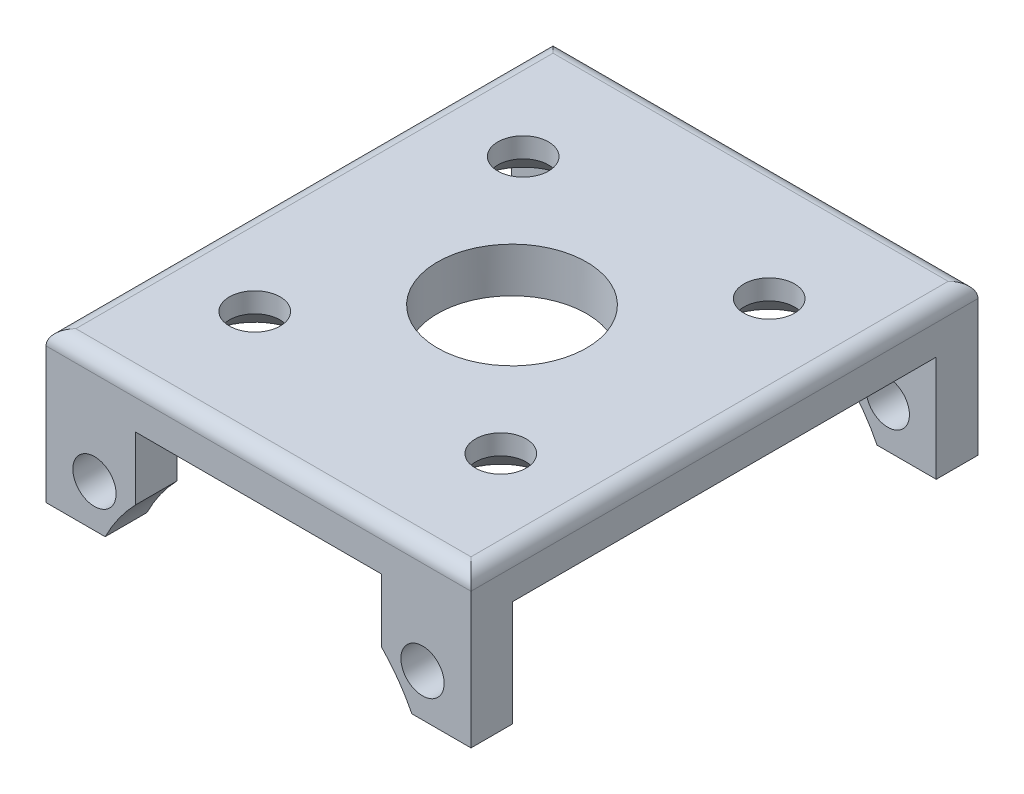
from build123d import *

# Parameters (mm, degrees)
BOSS_EXTRUDE7_DEPTH                          = 17
BOSS_EXTRUDE7_DEPTH_BACK                     = 17
SKETCH1_R                                    = 1.45
SKETCH34_W                                   = 28.4
SKETCH34_H                                   = 7.5
CUT_EXTRUDE11_DEPTH                          = 37.521397837
SKETCH35_R                                   = 5
CUT_EXTRUDE12_DEPTH                          = 25.542055741
CSK_FOR_M3_HEX_SOCKET_COUNTERSUNK_CA_2_COUNT = 2
CSK_FOR_M3_HEX_SOCKET_COUNTERSUNK_CA_2_PITCH = 16.5
CSK_FOR_M3_HEX_SOCKET_COUNTERSUNK_CA_3_COUNT = 2
CSK_FOR_M3_HEX_SOCKET_COUNTERSUNK_CA_3_PITCH = 18
CSK_FOR_M3_HEX_SOCKET_COUNTERSUNK_CA_4_COUNT = 2
CSK_FOR_M3_HEX_SOCKET_COUNTERSUNK_CA_4_PITCH = 24.418230894
FILLET5_R                                    = 1
SKETCH41_W                                   = 28.5
SKETCH41_H                                   = 0.4
CUT_EXTRUDE13_DEPTH                          = 40.895175147


with BuildPart() as part:
    # Sketch1 → Boss-Extrude7 (new, two sides: drawn at the far end of the back side and taken through both)
    with BuildSketch(Plane.XY.offset(-BOSS_EXTRUDE7_DEPTH_BACK)):
        with BuildLine():
            Line((-14.25, 15.25), (-14.25, 4.75))
            Line((-14.25, 4.75), (-10.473180033, 4.75))
            ThreePointArc((-10.473180033, 4.75), (-9.502581542, 6.476954843), (-8.25, 8.011710179))
            Line((-8.25, 8.011710179), (-8.25, 12.25))
            Line((-8.25, 12.25), (8.25, 12.25))
            Line((8.25, 12.25), (8.25, 8.011710179))
            ThreePointArc((8.25, 8.011710179), (9.502581542, 6.476954843), (10.473180033, 4.75))
            Line((10.473180033, 4.75), (14.25, 4.75))
            Line((14.25, 4.75), (14.25, 15.25))
            Line((14.25, 15.25), (-14.25, 15.25))
        make_face()
        with Locations((11, 8)):
            Circle(SKETCH1_R, mode=Mode.SUBTRACT)
        with Locations((-11, 8)):
            Circle(SKETCH1_R, mode=Mode.SUBTRACT)
    extrude(amount=BOSS_EXTRUDE7_DEPTH + BOSS_EXTRUDE7_DEPTH_BACK)

    # Sketch34 → Cut-Extrude11 (cut, through all)
    with BuildSketch(Plane.ZY.offset(14.25)):
        with Locations((0, 8.5)):
            Rectangle(SKETCH34_W, SKETCH34_H)
    extrude(amount=-CUT_EXTRUDE11_DEPTH, mode=Mode.SUBTRACT)

    # Sketch35 → Cut-Extrude12 (cut, through all)
    with BuildSketch(Plane(origin=(0, 15.25, 0), x_dir=(1, 0, 0), z_dir=(0, 1, 0))):
        Circle(SKETCH35_R)
    extrude(amount=-CUT_EXTRUDE12_DEPTH, mode=Mode.SUBTRACT)

    # Sketch40 → CSK for M3 Hex Socket Countersunk Cap Screw3 (revolve, cut)
    with BuildSketch(Plane(origin=(-8.25, 12.25, 9), x_dir=(0, 0, -1), z_dir=(1, 0, 0))):
        Polygon((0, 0), (0, 3), (1.7, 3), (1.7, 1.66), (3.36, 0), align=None)
    csk_for_m3_hex_socket_countersunk_cap_sc = revolve(axis=Axis((-8.25, 5.9, 9), (0, 1, 0)), mode=Mode.SUBTRACT)

    # CSK for M3 Hex Socket Countersunk Ca 2: CSK for M3 Hex Socket Countersunk Cap Screw3 ×2
    with Locations(*[(i * CSK_FOR_M3_HEX_SOCKET_COUNTERSUNK_CA_2_PITCH, 0, 0) for i in range(1, CSK_FOR_M3_HEX_SOCKET_COUNTERSUNK_CA_2_COUNT)]):
        add(csk_for_m3_hex_socket_countersunk_cap_sc, mode=Mode.SUBTRACT)

    # CSK for M3 Hex Socket Countersunk Ca 3: CSK for M3 Hex Socket Countersunk Cap Screw3 ×2
    with Locations(*[(0, 0, -i * CSK_FOR_M3_HEX_SOCKET_COUNTERSUNK_CA_3_PITCH) for i in range(1, CSK_FOR_M3_HEX_SOCKET_COUNTERSUNK_CA_3_COUNT)]):
        add(csk_for_m3_hex_socket_countersunk_cap_sc, mode=Mode.SUBTRACT)

    # CSK for M3 Hex Socket Countersunk Ca 4: CSK for M3 Hex Socket Countersunk Cap Screw3 ×2
    with Locations(*[Vector(0.6757246285173466, 0, -0.7371541402007413) * (i * CSK_FOR_M3_HEX_SOCKET_COUNTERSUNK_CA_4_PITCH) for i in range(1, CSK_FOR_M3_HEX_SOCKET_COUNTERSUNK_CA_4_COUNT)]):
        add(csk_for_m3_hex_socket_countersunk_cap_sc, mode=Mode.SUBTRACT)

    # Fillet5
    fillet5_edges = [part.edges().sort_by_distance(p)[0] for p in [
        (14.25, 15.25, 0),
        (-14.25, 15.25, 0),
        (0, 15.25, -17),
        (0, 15.25, 17),
    ]]
    fillet(fillet5_edges, radius=FILLET5_R)

    # Sketch41 → Cut-Extrude13 (cut, through all)
    with BuildSketch(Plane.XY.offset(17)):
        with Locations((0, 4.95)):
            Rectangle(SKETCH41_W, SKETCH41_H)
    extrude(amount=-CUT_EXTRUDE13_DEPTH, mode=Mode.SUBTRACT)


solid = part.part
